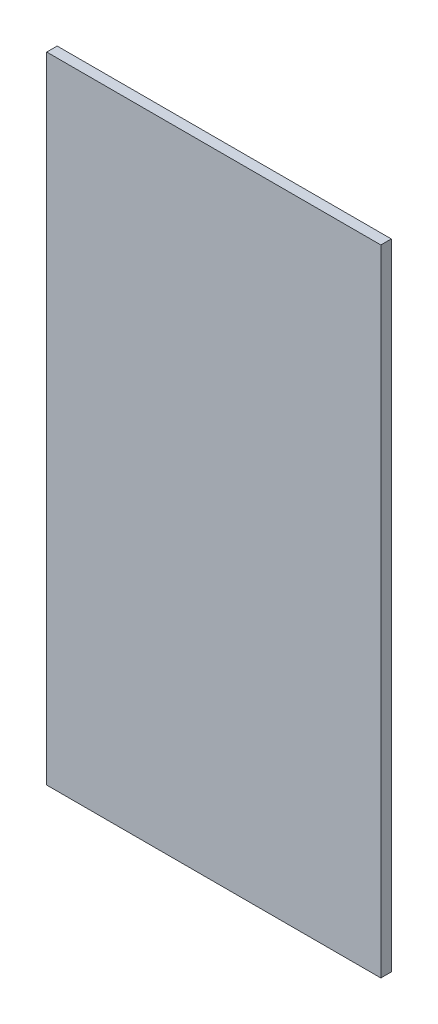
from build123d import *

# Parameters (mm, degrees)
SKETCH3_W           = 50.8
SKETCH3_H           = 96.52
BOSS_EXTRUDE1_DEPTH = 1.5875


with BuildPart() as part:
    # Sketch3 → Boss-Extrude1 (new body)
    with BuildSketch(Plane.XY):
        with Locations((25.4, 48.26)):
            Rectangle(SKETCH3_W, SKETCH3_H)
    extrude(amount=BOSS_EXTRUDE1_DEPTH)


solid = part.part
